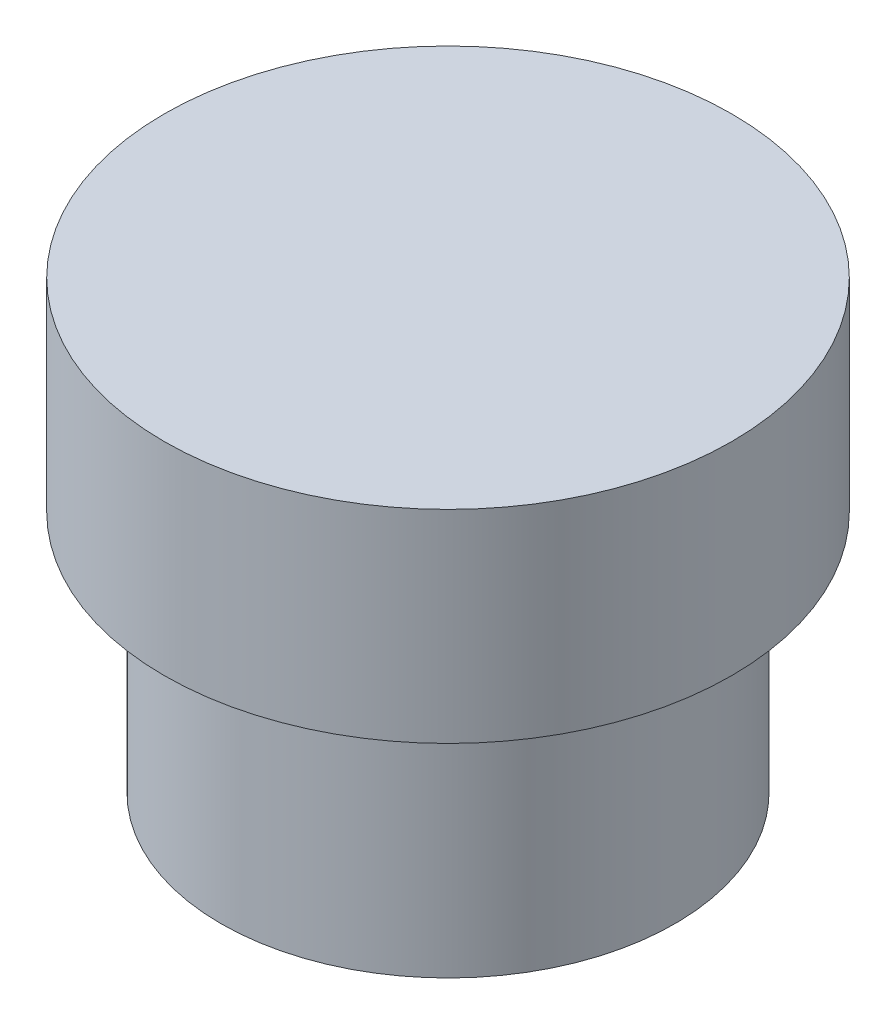
from build123d import *


with BuildPart() as part:
    # Sketch2 → Revolve1 (revolve)
    with BuildSketch(Plane.XY, mode=Mode.PRIVATE) as revolve1_sk:
        Polygon((0, 0), (5.6, 0), (5.6, 6), (7, 6), (7, 11), (0, 11), align=None)
    revolve(revolve1_sk.sketch.rotate(Axis((0, 56.554829429, 0), (0, -1, 0)), 90), axis=Axis((0, 56.554829429, 0), (0, -1, 0)))


solid = part.part
